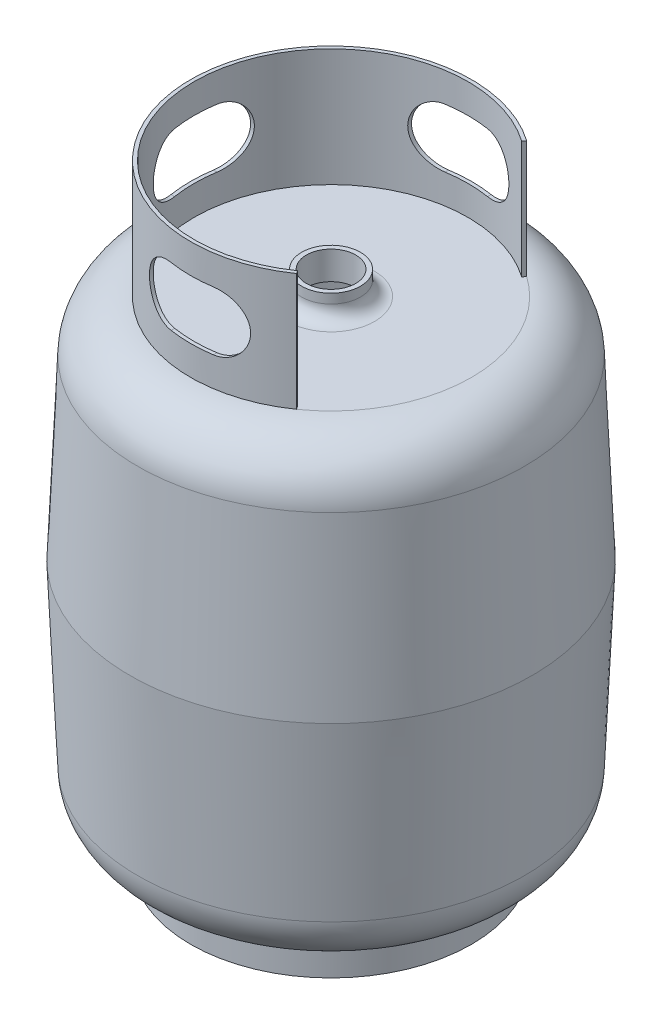
from build123d import *

# Parameters (mm, degrees)
CUT_EXTRUDE3_DEPTH      = 140
CUT_EXTRUDE3_DEPTH_BACK = 97
SKETCH2_R               = 21
FILLET3_R               = 12
SKETCH3_R               = 119.421871599
SKETCH3_R_2             = 116.421871599
BOSS_EXTRUDE1_DEPTH     = 30
BOSS_EXTRUDE3_START     = 100
BOSS_EXTRUDE3_DEPTH     = 100
CUT_EXTRUDE6_DEPTH      = 545.160288675
CUT_EXTRUDE6_DEPTH_BACK = 545.160288675
CUT_EXTRUDE7_DEPTH      = 545.160288764
CUT_EXTRUDE7_DEPTH_BACK = 545.160288764


with BuildPart() as part:
    # Sketch1 → Revolve2 (revolve)
    with BuildSketch(Plane.XY, mode=Mode.PRIVATE) as revolve2_sk:
        with BuildLine():
            Line((0, 0), (119.421871599, 0))
            ThreePointArc((119.421871599, 0), (150.539959109, 12.493621707), (164.37904157, 43.037127569))
            Line((164.37904157, 43.037127569), (170.959307689, 193.75))
            Line((170.959307689, 193.75), (164.37904157, 344.462872431))
            ThreePointArc((164.37904157, 344.462872431), (150.539959109, 375.006378293), (119.421871599, 387.5))
            Line((119.421871599, 387.5), (25, 387.5))
            Line((25, 387.5), (25, 407.5))
            Line((25, 407.5), (0, 407.5))
            Line((0, 407.5), (0, 403.5))
            Line((0, 403.5), (21, 403.5))
            Line((21, 403.5), (21, 383.5))
            Line((21, 383.5), (119.421871599, 383.5))
            ThreePointArc((119.421871599, 383.5), (147.773906886, 372.116922444), (160.382848683, 344.288394882))
            Line((160.382848683, 344.288394882), (166.955496948, 193.75))
            Line((166.955496948, 193.75), (160.382848683, 43.211605118))
            ThreePointArc((160.382848683, 43.211605118), (147.773906886, 15.383077556), (119.421871599, 4))
            Line((119.421871599, 4), (0, 4))
            Line((0, 4), (0, 0))
        make_face()
    revolve(revolve2_sk.sketch.rotate(Axis((0, 0, 0), (0, 1, 0)), 90), axis=Axis((0, 0, 0), (0, 1, 0)))

    # Sketch2 → Cut-Extrude3 (cut, two sides: drawn at the far end of the back side and taken through both)
    with BuildSketch(Plane(origin=(0, 387.5, 0), x_dir=(1, 0, 0), z_dir=(0, 1, 0)).offset(-CUT_EXTRUDE3_DEPTH_BACK)):
        with Locations(Location((0, 0, 0), (0, 0, 90))):
            Circle(SKETCH2_R)
    extrude(amount=CUT_EXTRUDE3_DEPTH + CUT_EXTRUDE3_DEPTH_BACK, mode=Mode.SUBTRACT)

    # Fillet3
    fillet3_edges = [part.edges().sort_by_distance(p)[0] for p in [
        (0, 387.5, 25),
    ]]
    fillet(fillet3_edges, radius=FILLET3_R)

    # Sketch3 → Boss-Extrude1 (add)
    with BuildSketch(Plane.XZ):
        with Locations(Location((0, 0, 0), (0, 0, 270))):
            Circle(SKETCH3_R)
        with Locations(Location((0, 0, 0), (0, 0, 270))):
            Circle(SKETCH3_R_2, mode=Mode.SUBTRACT)
    extrude(amount=BOSS_EXTRUDE1_DEPTH)

    # Sketch4 → Boss-Extrude3 (add)
    with BuildSketch(Plane(origin=(0, 387.5, 0), x_dir=(1, 0, 0), z_dir=(0, 1, 0)).offset(BOSS_EXTRUDE3_START)):
        with BuildLine():
            Line((68.497571534, 97.824670253), (66.776842225, 95.36721412))
            ThreePointArc((66.776842225, 95.36721412), (-116.421871599, 0), (66.776842225, -95.36721412))
            Line((66.776842225, -95.36721412), (68.497571534, -97.824670253))
            ThreePointArc((68.497571534, -97.824670253), (-119.421871599, 0), (68.497571534, 97.824670253))
        make_face()
    extrude(amount=-BOSS_EXTRUDE3_DEPTH)

    # Sketch6 → Cut-Extrude6 (cut, two sides: drawn at the far end of the back side and taken through both)
    with BuildSketch(Plane.XY.offset(-CUT_EXTRUDE6_DEPTH_BACK)):
        with BuildLine():
            Line((-18, 462.5), (18, 462.5))
            ThreePointArc((18, 462.5), (43, 437.5), (18, 412.5))
            Line((18, 412.5), (-18, 412.5))
            ThreePointArc((-18, 412.5), (-43, 437.5), (-18, 462.5))
        make_face()
    extrude(amount=CUT_EXTRUDE6_DEPTH + CUT_EXTRUDE6_DEPTH_BACK, mode=Mode.SUBTRACT)

    # Sketch8 → Cut-Extrude7 (cut, two sides: drawn at the far end of the back side and taken through both)
    with BuildSketch(Plane(origin=(0, 0, 0), x_dir=(0, 0, -1), z_dir=(1, 0, 0)).offset(-CUT_EXTRUDE7_DEPTH_BACK)):
        with BuildLine():
            Line((-18, 462.5), (18, 462.5))
            ThreePointArc((18, 462.5), (43, 437.5), (18, 412.5))
            Line((18, 412.5), (-18, 412.5))
            ThreePointArc((-18, 412.5), (-43, 437.5), (-18, 462.5))
        make_face()
    extrude(amount=CUT_EXTRUDE7_DEPTH + CUT_EXTRUDE7_DEPTH_BACK, mode=Mode.SUBTRACT)


solid = part.part
